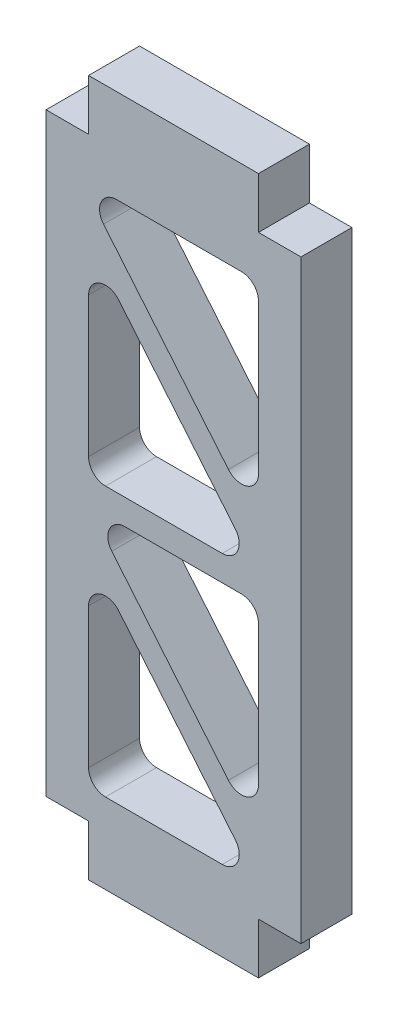
from build123d import *

# Parameters (mm, degrees)
SALIENTE_EXTRUIR1_DEPTH = 3


with BuildPart() as part:
    # Croquis1 → Saliente-Extruir1 (new body)
    with BuildSketch(Plane.XY):
        Polygon((-5, -20.5), (5, -20.5), (5, -17.5), (7.5, -17.5), (7.5, 17.5), (5, 17.5), (5, 20.5), (-5, 20.5), (-5, 17.5), (-7.5, 17.5), (-7.5, -17.5), (-5, -17.5), align=None)
        with BuildLine():
            ThreePointArc((-5, -6.533565594), (-4.340425264, -5.593294017), (-3.23177872, -5.893381195))
            Line((-3.23177872, -5.893381195), (3.638034467, -14.13715702))
            ThreePointArc((3.638034467, -14.13715702), (3.775402609, -15.201496816), (2.869813188, -15.77734142))
            Line((2.869813188, -15.77734142), (-4, -15.77734142))
            ThreePointArc((-4, -15.77734142), (-4.707106781, -15.484448201), (-5, -14.77734142))
            Line((-5, -14.77734142), (-5, -6.533565594))
        make_face(mode=Mode.SUBTRACT)
        with BuildLine():
            ThreePointArc((-3.633179667, -3.068625156), (-3.770547809, -2.00428536), (-2.864958387, -1.428440756))
            Line((-2.864958387, -1.428440756), (4, -1.428440756))
            ThreePointArc((4, -1.428440756), (4.707106781, -1.721333975), (5, -2.428440756))
            Line((5, -2.428440756), (5, -10.666390821))
            ThreePointArc((5, -10.666390821), (4.340425264, -11.606662399), (3.23177872, -11.306575221))
            Line((3.23177872, -11.306575221), (-3.633179667, -3.068625156))
        make_face(mode=Mode.SUBTRACT)
        with BuildLine():
            ThreePointArc((-5, 9.309509308), (-4.340425264, 10.249780886), (-3.23177872, 9.949693708))
            Line((-3.23177872, 9.949693708), (3.633179667, 1.711743643))
            ThreePointArc((3.633179667, 1.711743643), (3.770547809, 0.647403847), (2.864958387, 0.071559244))
            Line((2.864958387, 0.071559244), (-4, 0.071559244))
            ThreePointArc((-4, 0.071559244), (-4.707106781, 0.364452462), (-5, 1.071559244))
            Line((-5, 1.071559244), (-5, 9.309509308))
        make_face(mode=Mode.SUBTRACT)
        with BuildLine():
            Line((3.23177872, 4.536499682), (-4.120984545, 13.3598156))
            ThreePointArc((-4.120984545, 13.3598156), (-4.258352687, 14.424155396), (-3.352763265, 15))
            Line((-3.352763265, 15), (4, 15))
            ThreePointArc((4, 15), (4.707106781, 14.707106781), (5, 14))
            Line((5, 14), (5, 5.176684082))
            ThreePointArc((5, 5.176684082), (4.340425264, 4.236412504), (3.23177872, 4.536499682))
        make_face(mode=Mode.SUBTRACT)
    extrude(amount=SALIENTE_EXTRUIR1_DEPTH)


solid = part.part
